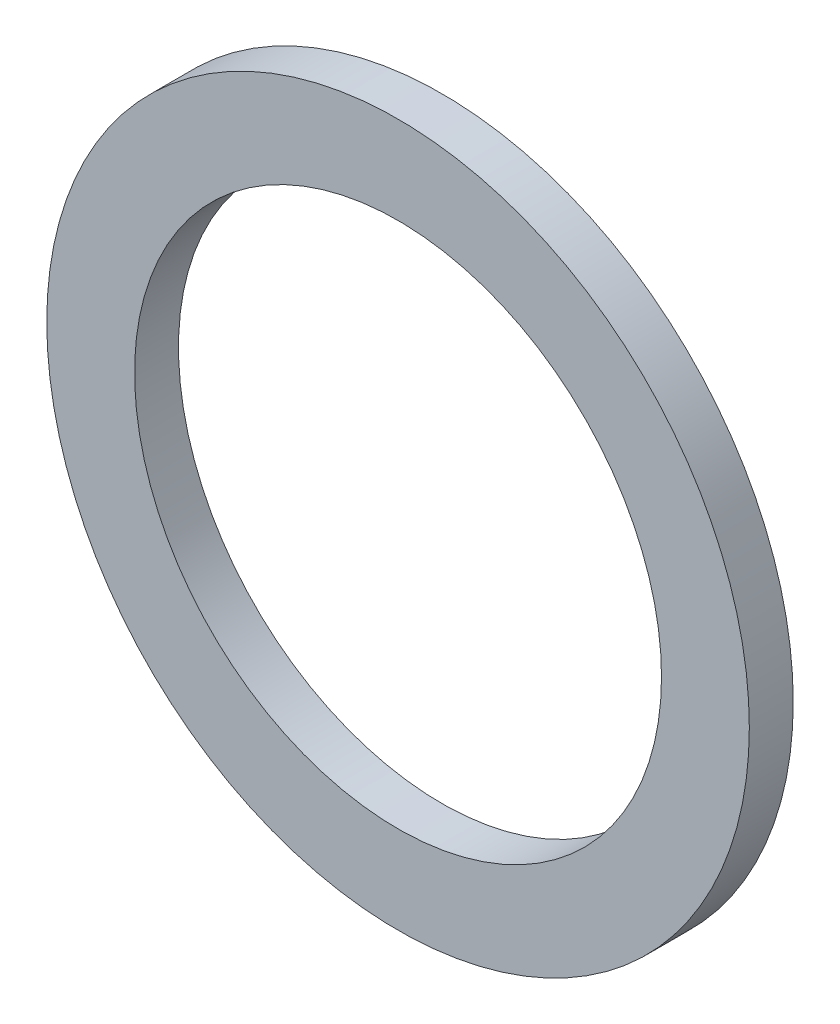
from build123d import *

# Parameters (mm, degrees)
SKETCH_1_R      = 8
SKETCH_1_R_2    = 6
EXTRUDE_1_DEPTH = 1


with BuildPart() as part:
    # 草图1 → 凸台-拉伸1 (new body)
    with BuildSketch(Plane.XY):
        Circle(SKETCH_1_R)
        Circle(SKETCH_1_R_2, mode=Mode.SUBTRACT)
    extrude(amount=EXTRUDE_1_DEPTH)


solid = part.part
